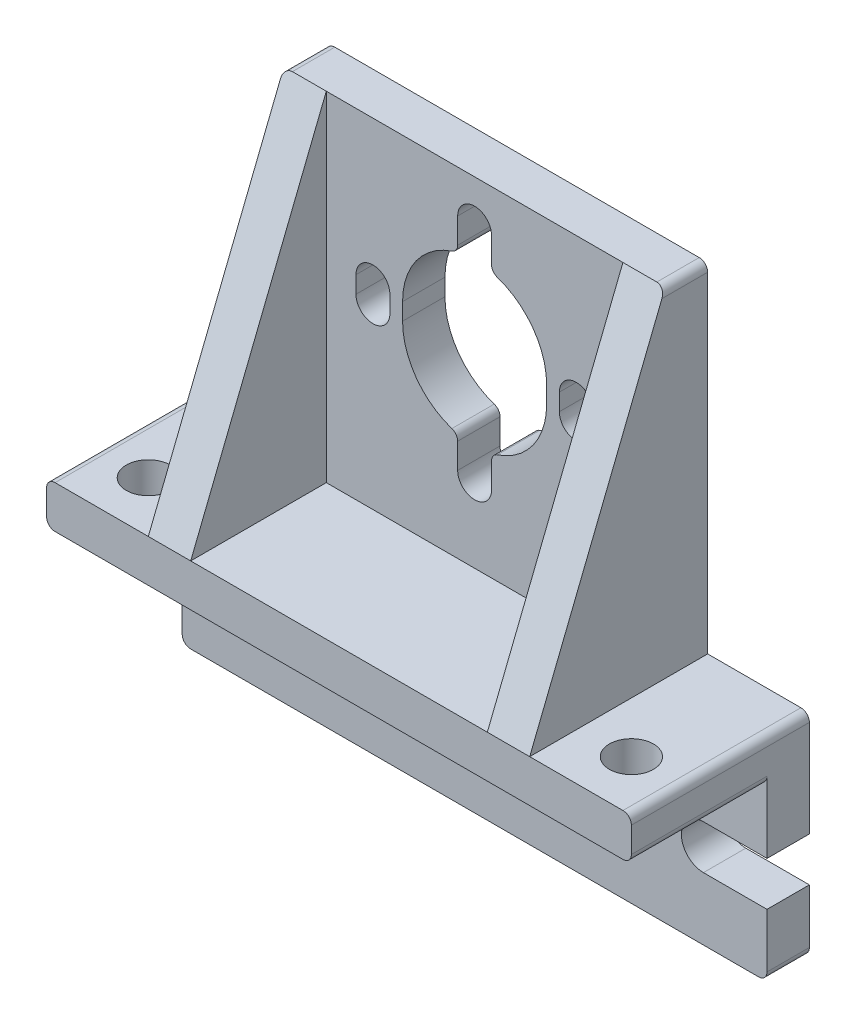
from build123d import *

# Parameters (mm, degrees)
BOSS_EXTRUDE1_DEPTH = 5
BOSS_EXTRUDE2_DEPTH = 16
CUT_EXTRUDE1_DEPTH  = 69.893033029
SKETCH4_R           = 2.6
CUT_EXTRUDE2_DEPTH  = 16
FILLET1_R           = 1
FILLET2_R           = 1


with BuildPart() as part:
    # Sketch1 → Boss-Extrude1 (new body)
    with BuildSketch(Plane.XY):
        with BuildLine():
            Line((-34.5, -25.1), (-34.5, -32.5))
            Line((-34.5, -32.5), (34.5, -32.5))
            Line((34.5, -32.5), (34.5, -25.1))
            Line((34.5, -25.1), (27, -25.1))
            ThreePointArc((27, -25.1), (24.4, -22.5), (27, -19.9))
            Line((27, -19.9), (34.5, -19.9))
            Line((34.5, -19.9), (34.5, -7.5))
            Line((34.5, -7.5), (22.5, -7.5))
            Line((22.5, -7.5), (22.5, 32.5))
            Line((22.5, 32.5), (-22.5, 32.5))
            Line((-22.5, 32.5), (-22.5, -7.5))
            Line((-22.5, -7.5), (-34.5, -7.5))
            Line((-34.5, -7.5), (-34.5, -19.9))
            Line((-34.5, -19.9), (-27, -19.9))
            ThreePointArc((-27, -19.9), (-24.4, -22.5), (-27, -25.1))
            Line((-27, -25.1), (-34.5, -25.1))
        make_face()
        with BuildLine():
            ThreePointArc((-14, 15.5), (-12, 17.5), (-10, 15.5))
            Line((-10, 15.5), (-10, 13.5))
            ThreePointArc((-10, 13.5), (-12, 11.5), (-14, 13.5))
            Line((-14, 13.5), (-14, 15.5))
        make_face(mode=Mode.SUBTRACT)
        with BuildLine():
            ThreePointArc((-2, 27.5), (0, 29.5), (2, 27.5))
            Line((2, 27.5), (2, 23.761355821))
            ThreePointArc((2, 23.761355821), (6.680194608, 20.75594901), (8.5, 15.5))
            Line((8.5, 15.5), (8.5, 13.5))
            ThreePointArc((8.5, 13.5), (6.680194608, 8.24405099), (2, 5.238644179))
            Line((2, 5.238644179), (2, 1.5))
            ThreePointArc((2, 1.5), (0, -0.5), (-2, 1.5))
            Line((-2, 1.5), (-2, 5.238644179))
            ThreePointArc((-2, 5.238644179), (-6.680194608, 8.24405099), (-8.5, 13.5))
            Line((-8.5, 13.5), (-8.5, 15.5))
            ThreePointArc((-8.5, 15.5), (-6.680194608, 20.75594901), (-2, 23.761355821))
            Line((-2, 23.761355821), (-2, 27.5))
        make_face(mode=Mode.SUBTRACT)
        with BuildLine():
            Line((10, 13.5), (10, 15.5))
            ThreePointArc((10, 15.5), (12, 17.5), (14, 15.5))
            Line((14, 15.5), (14, 13.5))
            ThreePointArc((14, 13.5), (12, 11.5), (10, 13.5))
        make_face(mode=Mode.SUBTRACT)
    extrude(amount=BOSS_EXTRUDE1_DEPTH)

    # Sketch2 → Boss-Extrude2 (add)
    with BuildSketch(Plane.XY.offset(5)):
        Polygon((-22.5, 32.5), (-17.5, 32.5), (-17.5, -7.5), (17.5, -7.5), (17.5, 32.5), (22.5, 32.5), (22.5, -7.5), (34.5, -7.5), (34.5, -12.5), (-34.5, -12.5), (-34.5, -7.5), (-22.5, -7.5), align=None)
    extrude(amount=BOSS_EXTRUDE2_DEPTH)

    # Sketch3 → Cut-Extrude1 (cut, through all)
    with BuildSketch(Plane(origin=(22.5, 0, 0), x_dir=(0, 0, -1), z_dir=(1, 0, 0))):
        Polygon((-21, -7.5), (-21, 32.5), (-5, 32.5), align=None)
    extrude(amount=-CUT_EXTRUDE1_DEPTH, mode=Mode.SUBTRACT)

    # Sketch4 → Cut-Extrude2 (cut)
    with BuildSketch(Plane.XZ.offset(12.5)):
        with Locations((-28.5, 15)):
            Circle(SKETCH4_R)
        with Locations(Location((28.5, 15, 0), (0, 0, 90))):
            Circle(SKETCH4_R)
    extrude(amount=-CUT_EXTRUDE2_DEPTH, mode=Mode.SUBTRACT)

    # Fillet1
    fillet1_edges = [part.edges().sort_by_distance(p)[0] for p in [
        (-34.5, -12.5, 13),
        (34.5, -12.5, 13),
        (-22.5, 32.5, 2.5),
        (22.5, 32.5, 2.5),
        (34.5, -32.5, 2.5),
        (-34.5, -32.5, 2.5),
        (-34.5, -7.5, 10.5),
        (34.5, -7.5, 10.5),
    ]]
    fillet(fillet1_edges, radius=FILLET1_R)

    # Fillet2
    fillet2_edges = [part.edges().sort_by_distance(p)[0] for p in [
        (-2, 5.238644179, 2.5),
        (2, 5.238644179, 2.5),
        (2, 23.761355821, 2.5),
        (-2, 23.761355821, 2.5),
    ]]
    fillet(fillet2_edges, radius=FILLET2_R)


solid = part.part
